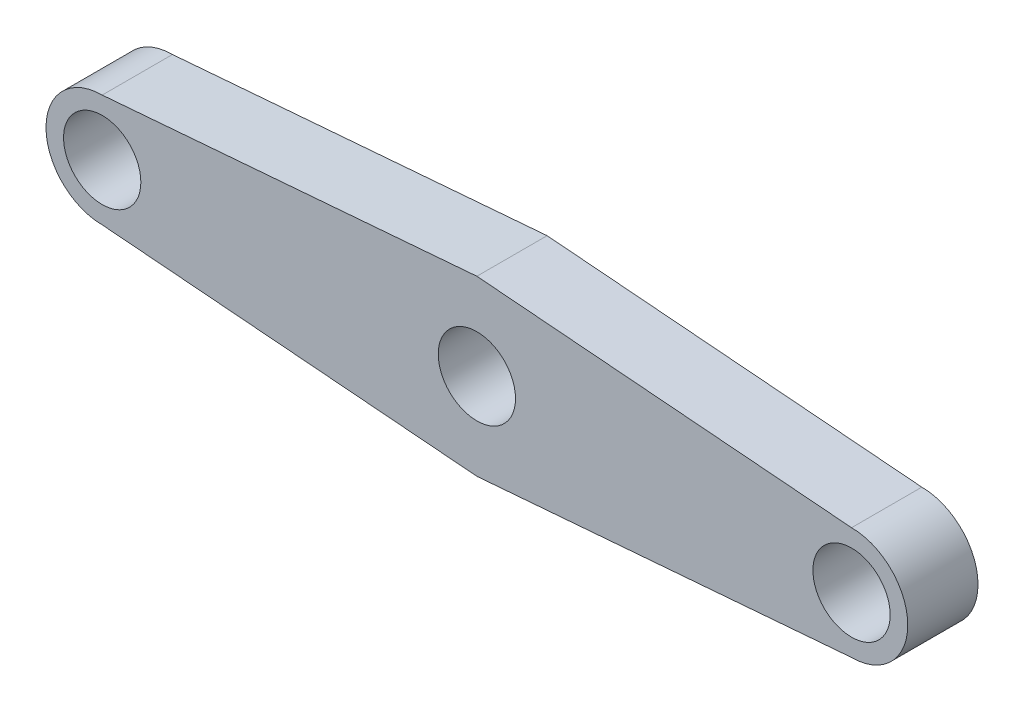
from build123d import *

# Parameters (mm, degrees)
SKETCH_1_R      = 1.65
EXTRUDE_1_DEPTH = 3


with BuildPart() as part:
    # 草图1 → 凸台-拉伸1 (new body)
    with BuildSketch(Plane.XY):
        with BuildLine():
            ThreePointArc((-16, 2.4), (-18.4, 0), (-16, -2.4))
            Line((-16, -2.4), (0, -3.7))
            Line((0, -3.7), (16, -2.4))
            ThreePointArc((16, -2.4), (18.4, 0), (16, 2.4))
            Line((16, 2.4), (0, 3.7))
            Line((0, 3.7), (-16, 2.4))
        make_face()
        with Locations((-16, 0)):
            Circle(SKETCH_1_R, mode=Mode.SUBTRACT)
        Circle(SKETCH_1_R, mode=Mode.SUBTRACT)
        with Locations((16, 0)):
            Circle(SKETCH_1_R, mode=Mode.SUBTRACT)
    extrude(amount=EXTRUDE_1_DEPTH)


solid = part.part
